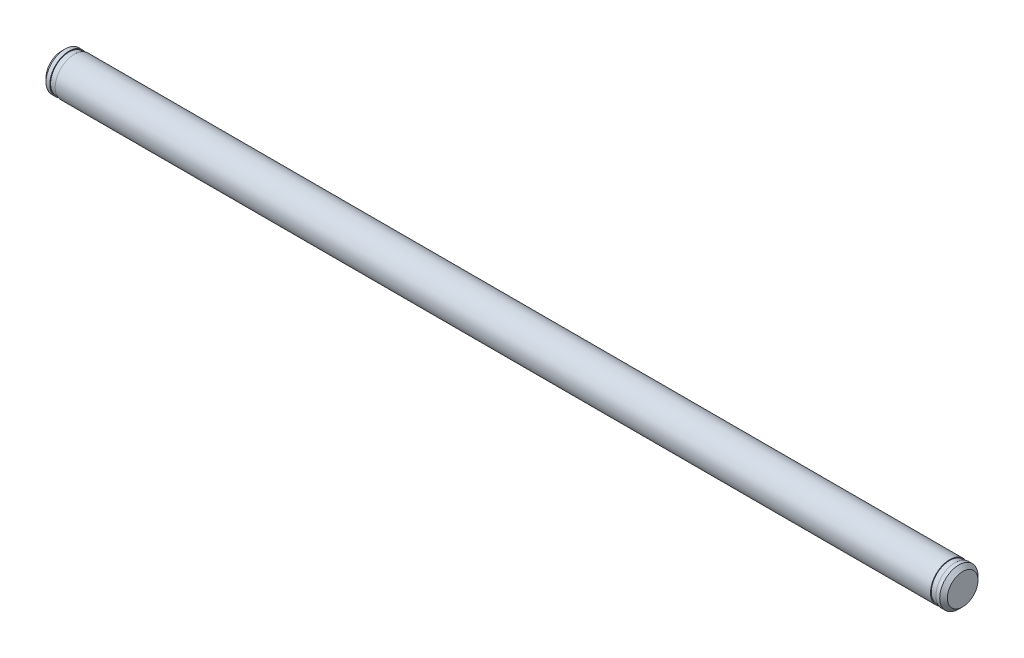
from build123d import *

# Parameters (mm, degrees)
CHAMFER_1_SIZE = 0.5


with BuildPart() as part:
    # 草图1 → 旋转1 (revolve)
    with BuildSketch(Plane.XY):
        Polygon((58.85, 0), (58.85, 2.5), (57.85, 2.5), (57.85, 2.4), (57.15, 2.4), (57.15, 2.5), (-57.15, 2.5), (-57.15, 2.4), (-57.85, 2.4), (-57.85, 2.5), (-58.85, 2.5), (-58.85, 0), align=None)
    revolve(axis=Axis((58.85, 0, 0), (-1, 0, 0)))

    # 倒角1
    chamfer_1_edges = [part.edges().sort_by_distance(p)[0] for p in [
        (-58.85, -2.5, 0),
        (58.85, -2.5, 0),
    ]]
    chamfer(chamfer_1_edges, length=CHAMFER_1_SIZE)


solid = part.part
